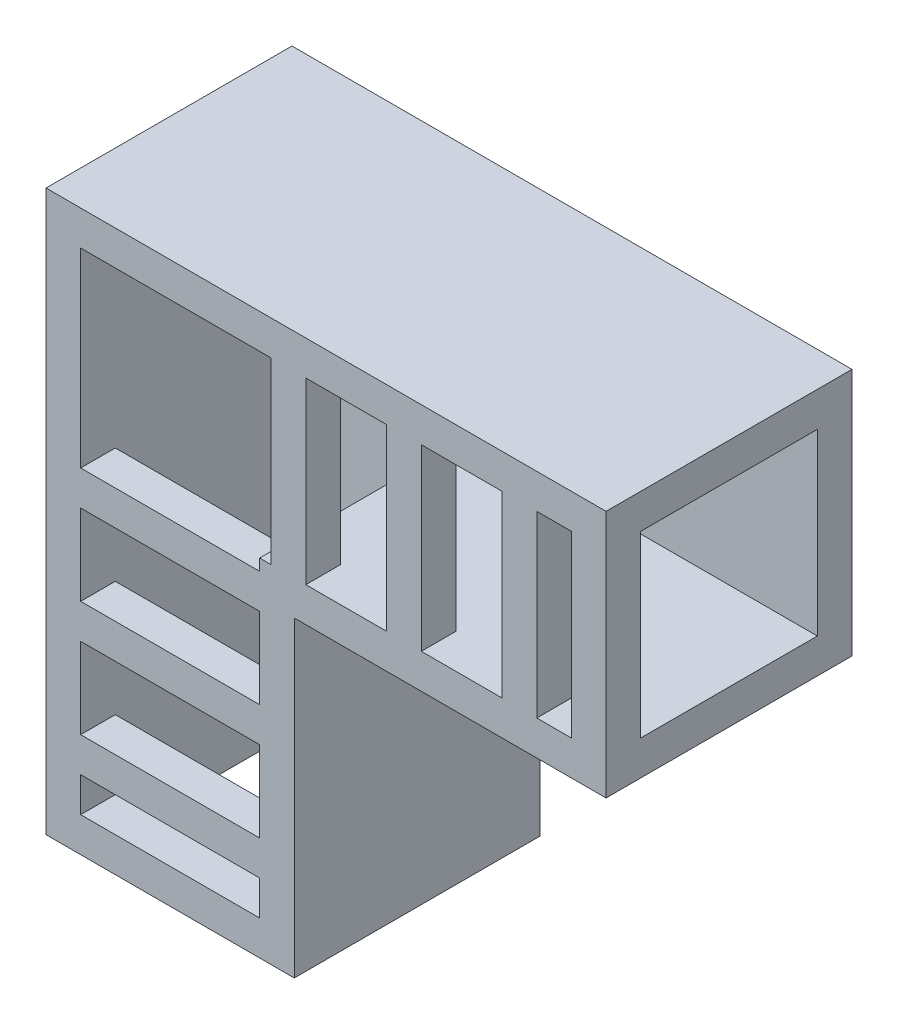
from build123d import *

# Parameters (mm, degrees)
BOSS_EXTRUDE1_DEPTH = 15.3
SHELL1_T            = 3
SKETCH2_W           = 7
SKETCH2_H           = 15.5
SKETCH2_W_2         = 3
SKETCH2_W_3         = 15.5
SKETCH2_H_2         = 7
SKETCH2_H_3         = 3
CUT_EXTRUDE1_DEPTH  = 5


with BuildPart() as part:
    # Sketch1 → Boss-Extrude1 (new body)
    with BuildSketch(Plane.XY):
        Polygon((0, 0), (15.5, 0), (15.5, 30), (45.5, 30), (45.5, 45.5), (0, 45.5), align=None)
    extrude(amount=BOSS_EXTRUDE1_DEPTH)

    # Shell1
    shell1_openings = [part.faces().sort_by_distance(p)[0] for p in [
        (7.75, 0, 7.65),
        (45.5, 37.75, 7.65),
    ]]
    offset(amount=SHELL1_T, openings=shell1_openings, kind=Kind.INTERSECTION)

    # Sketch2 → Cut-Extrude1 (cut)
    with BuildSketch(Plane.XY.offset(18.3)):
        Polygon((15.5, 30), (16.5, 30), (16.5, 45.5), (0, 45.5), (0, 29), (15.5, 29), align=None)
        with Locations((23, 37.75)):
            Rectangle(SKETCH2_W, SKETCH2_H)
        with Locations((33, 37.75)):
            Rectangle(SKETCH2_W, SKETCH2_H)
        with Locations((41, 37.75)):
            Rectangle(SKETCH2_W_2, SKETCH2_H)
        with Locations((7.75, 22.5)):
            Rectangle(SKETCH2_W_3, SKETCH2_H_2)
        with Locations((7.75, 12.5)):
            Rectangle(SKETCH2_W_3, SKETCH2_H_2)
        with Locations((7.75, 4.5)):
            Rectangle(SKETCH2_W_3, SKETCH2_H_3)
    extrude(amount=-CUT_EXTRUDE1_DEPTH, mode=Mode.SUBTRACT)


solid = part.part
